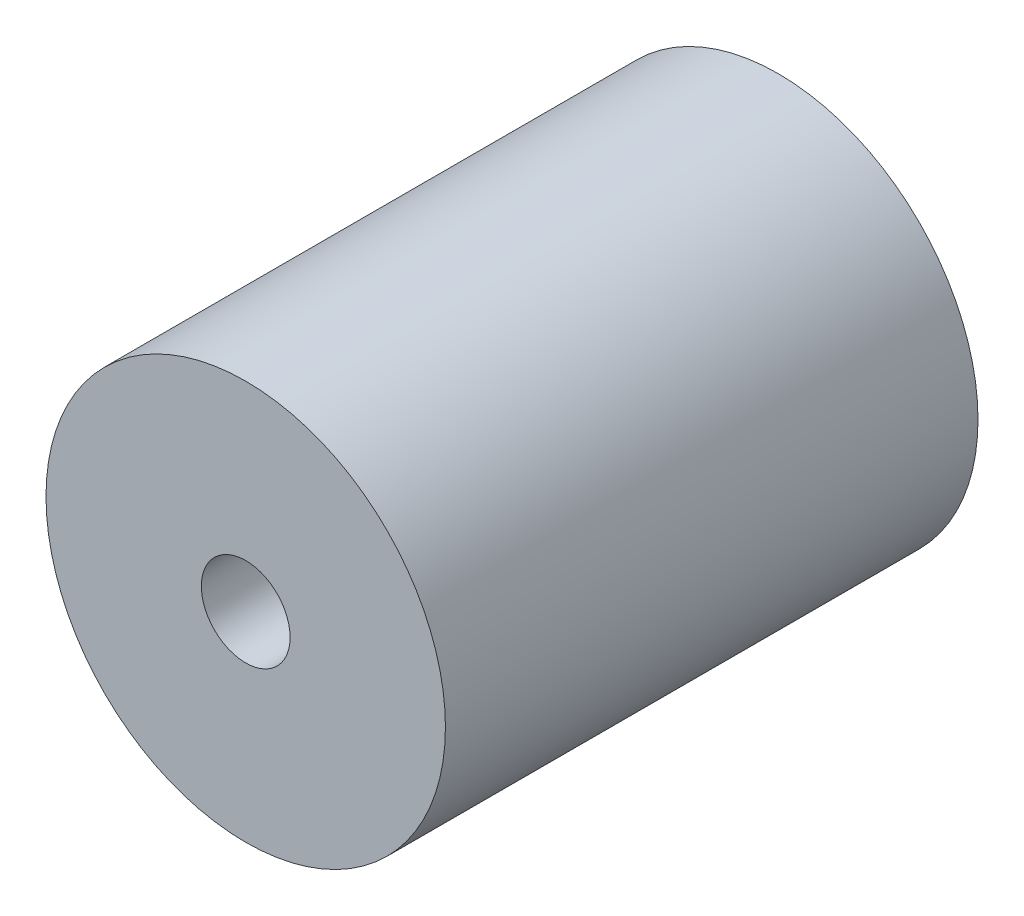
from build123d import *

# Parameters (mm, degrees)
ESQUISSE1_R             = 14.2875
BOSS_EXTRU_1_DEPTH      = 38.1
ESQUISSE2_R             = 3.175
ENL_V_MAT_EXTRU_1_DEPTH = 44.12627172


with BuildPart() as part:
    # Esquisse1 → Boss.-Extru.1 (new body)
    with BuildSketch(Plane.XY):
        with Locations(Location((0, 0, 0), (0, 0, 180))):
            Circle(ESQUISSE1_R)
    extrude(amount=BOSS_EXTRU_1_DEPTH)

    # Esquisse2 → Enlèv. mat.-Extru.1 (cut, through all)
    with BuildSketch(Plane.XY.offset(38.1)):
        Circle(ESQUISSE2_R)
    extrude(amount=-ENL_V_MAT_EXTRU_1_DEPTH, mode=Mode.SUBTRACT)


solid = part.part
